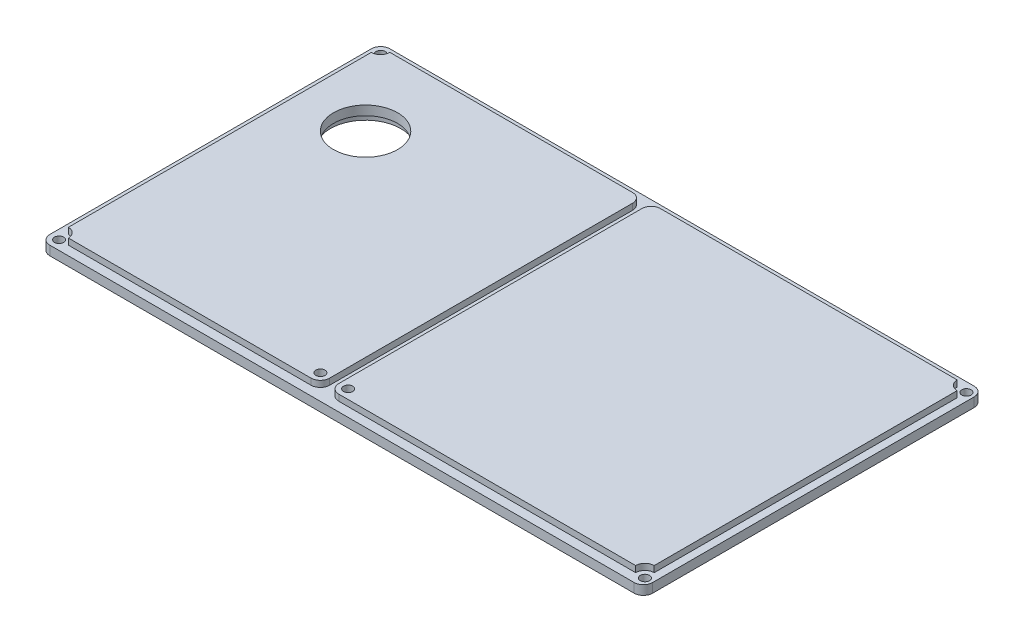
from build123d import *

# Parameters (mm, degrees)
SKETCH1_W           = 195
SKETCH1_H           = 110
BOSS_EXTRUDE1_DEPTH = 3
BOSS_EXTRUDE2_DEPTH = 2
SKETCH4_R           = 1.5
CUT_EXTRUDE2_DEPTH  = 112.983257677
FILLET1_R           = 3
SKETCH5_R           = 1.5
CUT_EXTRUDE3_DEPTH  = 113.054674155
SKETCH6_R           = 10.35
CUT_EXTRUDE4_DEPTH  = 113.054674155
SKETCH7_R           = 11.4
CUT_EXTRUDE5_DEPTH  = 2


with BuildPart() as part:
    # Sketch1 → Boss-Extrude1 (new body)
    with BuildSketch(Plane(origin=(0, 0, 0), x_dir=(1, 0, 0), z_dir=(0, 1, 0))):
        Rectangle(SKETCH1_W, SKETCH1_H)
    extrude(amount=BOSS_EXTRUDE1_DEPTH)

    # Sketch2 → Boss-Extrude2 (add)
    with BuildSketch(Plane(origin=(0, 3, 0), x_dir=(1, 0, 0), z_dir=(0, 1, 0))):
        with BuildLine():
            Line((-94.5, 0), (-94.5, 49))
            ThreePointArc((-94.5, 49), (-92.378679656, 49.878679656), (-91.5, 52))
            Line((-91.5, 52), (-13, 52))
            ThreePointArc((-13, 52), (-10.878679656, 51.121320344), (-10, 49))
            Line((-10, 49), (-10, -49))
            ThreePointArc((-10, -49), (-10.878679656, -51.121320344), (-13, -52))
            Line((-13, -52), (-91.5, -52))
            ThreePointArc((-91.5, -52), (-92.378679656, -49.878679656), (-94.5, -49))
            Line((-94.5, -49), (-94.5, 0))
        make_face()
        with BuildLine():
            Line((-7, 0), (-7, 49))
            ThreePointArc((-7, 49), (-6.121320344, 51.121320344), (-4, 52))
            Line((-4, 52), (92, 52))
            ThreePointArc((92, 52), (92.878679656, 49.878679656), (95, 49))
            Line((95, 49), (95, -49))
            ThreePointArc((95, -49), (92.878679656, -49.878679656), (92, -52))
            Line((92, -52), (-4, -52))
            ThreePointArc((-4, -52), (-6.121320344, -51.121320344), (-7, -49))
            Line((-7, -49), (-7, 0))
        make_face()
    extrude(amount=BOSS_EXTRUDE2_DEPTH)

    # Sketch4 → Cut-Extrude2 (cut, through all)
    with BuildSketch(Plane(origin=(0, 3, 0), x_dir=(1, 0, 0), z_dir=(0, 1, 0))):
        with Locations(Location((-94.5, 52, 0), (0, 0, 270))):
            Circle(SKETCH4_R)
        with Locations(Location((95, 52, 0), (0, 0, 270))):
            Circle(SKETCH4_R)
        with Locations(Location((95, -52, 0), (0, 0, 270))):
            Circle(SKETCH4_R)
        with Locations(Location((-94.5, -52, 0), (0, 0, 270))):
            Circle(SKETCH4_R)
    extrude(amount=-CUT_EXTRUDE2_DEPTH, mode=Mode.SUBTRACT)

    # Fillet1
    fillet1_edges = [part.edges().sort_by_distance(p)[0] for p in [
        (97.5, 1.5, 55),
        (-97.5, 1.5, 55),
        (-97.5, 1.5, -55),
        (97.5, 1.5, -55),
    ]]
    fillet(fillet1_edges, radius=FILLET1_R)

    # Sketch5 → Cut-Extrude3 (cut, through all)
    with BuildSketch(Plane(origin=(0, 5, 0), x_dir=(1, 0, 0), z_dir=(0, 1, 0))):
        with Locations(Location((-13, -49, 0), (0, 0, 270))):
            Circle(SKETCH5_R)
        with Locations(Location((-4, -49, 0), (0, 0, 270))):
            Circle(SKETCH5_R)
    extrude(amount=-CUT_EXTRUDE3_DEPTH, mode=Mode.SUBTRACT)

    # Sketch6 → Cut-Extrude4 (cut, through all)
    with BuildSketch(Plane(origin=(0, 5, 0), x_dir=(1, 0, 0), z_dir=(0, 1, 0))):
        with Locations(Location((-73.375, 26, 0), (0, 0, 270))):
            Circle(SKETCH6_R)
    extrude(amount=-CUT_EXTRUDE4_DEPTH, mode=Mode.SUBTRACT)

    # Sketch7 → Cut-Extrude5 (cut)
    with BuildSketch(Plane.XZ):
        with Locations(Location((-73.375, -26, 0), (0, 0, 270))):
            Circle(SKETCH7_R)
    extrude(amount=-CUT_EXTRUDE5_DEPTH, mode=Mode.SUBTRACT)


solid = part.part
